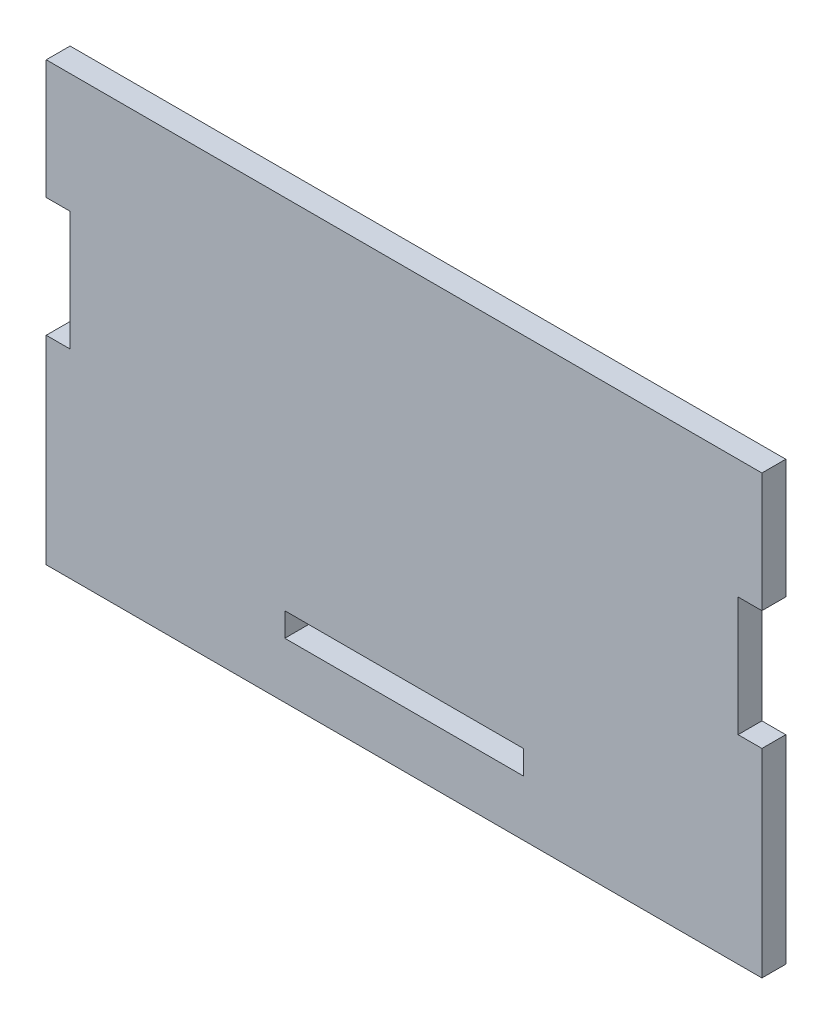
from build123d import *

# Parameters (mm, degrees)
SKETCH1_W           = 30
SKETCH1_H           = 3
BOSS_EXTRUDE1_DEPTH = 3


with BuildPart() as part:
    # Sketch1 → Boss-Extrude1 (new body)
    with BuildSketch(Plane.XY):
        Polygon((-45, 27.5), (-45, 12.5), (-42, 12.5), (-42, -2.5), (-45, -2.5), (-45, -27.5), (45, -27.5), (45, -2.5), (42, -2.5), (42, 12.5), (45, 12.5), (45, 27.5), align=None)
        with Locations((0, -19)):
            Rectangle(SKETCH1_W, SKETCH1_H, mode=Mode.SUBTRACT)
    extrude(amount=BOSS_EXTRUDE1_DEPTH)


solid = part.part
